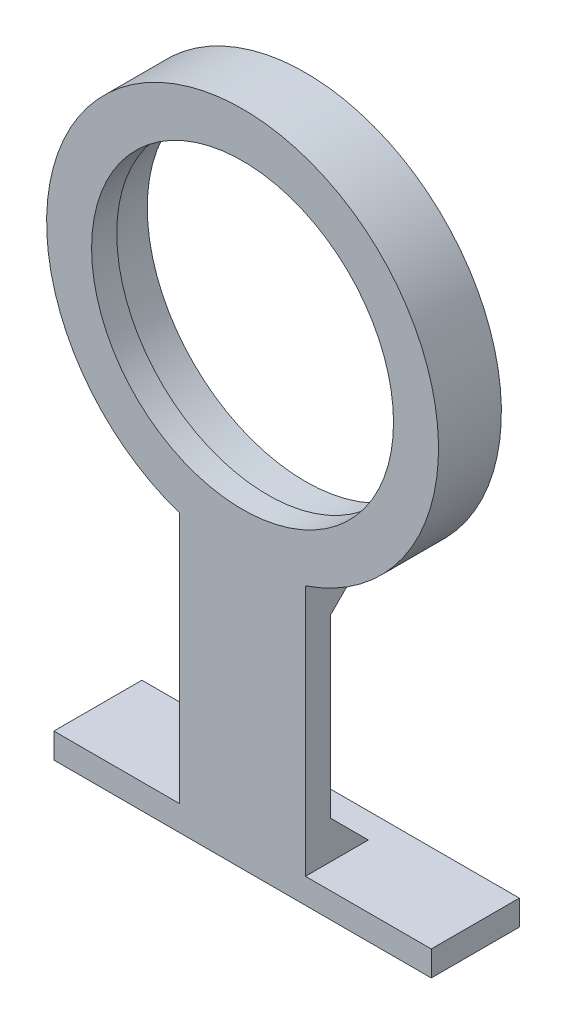
from build123d import *

# Parameters (mm, degrees)
BOSS_EXTRUDE1_DEPTH      = 2
BOSS_EXTRUDE1_DEPTH_BACK = 1
SKETCH1_R                = 12.575
SKETCH2_R                = 12
BOSS_EXTRUDE2_DEPTH      = 2
CUT_EXTRUDE1_DEPTH       = 43.30766223
BOSS_EXTRUDE3_DEPTH      = 2


with BuildPart() as part:
    # Sketch1 → Boss-Extrude1 (new, two sides: drawn at the far end of the back side and taken through both)
    with BuildSketch(Plane.XY.offset(-BOSS_EXTRUDE1_DEPTH_BACK)):
        with BuildLine():
            Line((5, -34.750614394), (15, -34.750614394))
            Line((15, -34.750614394), (15, -36.750614394))
            Line((15, -36.750614394), (-15, -36.750614394))
            Line((-15, -36.750614394), (-15, -34.750614394))
            Line((-15, -34.750614394), (-5, -34.750614394))
            Line((-5, -34.750614394), (-5, -14.750614394))
            ThreePointArc((-5, -14.750614394), (0, 15.575), (5, -14.750614394))
            Line((5, -14.750614394), (5, -34.750614394))
        make_face()
        Circle(SKETCH1_R, mode=Mode.SUBTRACT)
    extrude(amount=BOSS_EXTRUDE1_DEPTH + BOSS_EXTRUDE1_DEPTH_BACK)

    # Sketch2 → Boss-Extrude2 (add)
    with BuildSketch(Plane.XY.offset(2)):
        with BuildLine():
            Line((-5, -14.750614394), (-5, -34.750614394))
            Line((-5, -34.750614394), (-15, -34.750614394))
            Line((-15, -34.750614394), (-15, -36.750614394))
            Line((-15, -36.750614394), (15, -36.750614394))
            Line((15, -36.750614394), (15, -34.750614394))
            Line((15, -34.750614394), (5, -34.750614394))
            Line((5, -34.750614394), (5, -14.750614394))
            ThreePointArc((5, -14.750614394), (0, 15.575), (-5, -14.750614394))
        make_face()
        Circle(SKETCH2_R, mode=Mode.SUBTRACT)
    extrude(amount=BOSS_EXTRUDE2_DEPTH)

    # Sketch4 → Cut-Extrude1 (cut, through all)
    with BuildSketch(Plane.ZY.offset(5)):
        Polygon((-1, -14.750614394), (2, -17.750614394), (2, -31.750614394), (-1, -34.750614394), align=None)
    extrude(amount=-CUT_EXTRUDE1_DEPTH, mode=Mode.SUBTRACT)

    # Sketch5 → Boss-Extrude3 (add)
    with BuildSketch(Plane(origin=(0, 0, -1), x_dir=(-1, 0, 0), z_dir=(0, 0, -1))):
        Polygon((15, -34.750614394), (5, -34.750614394), (-5, -34.750614394), (-15, -34.750614394), (-15, -36.750614394), (15, -36.750614394), align=None)
    extrude(amount=BOSS_EXTRUDE3_DEPTH)


solid = part.part
